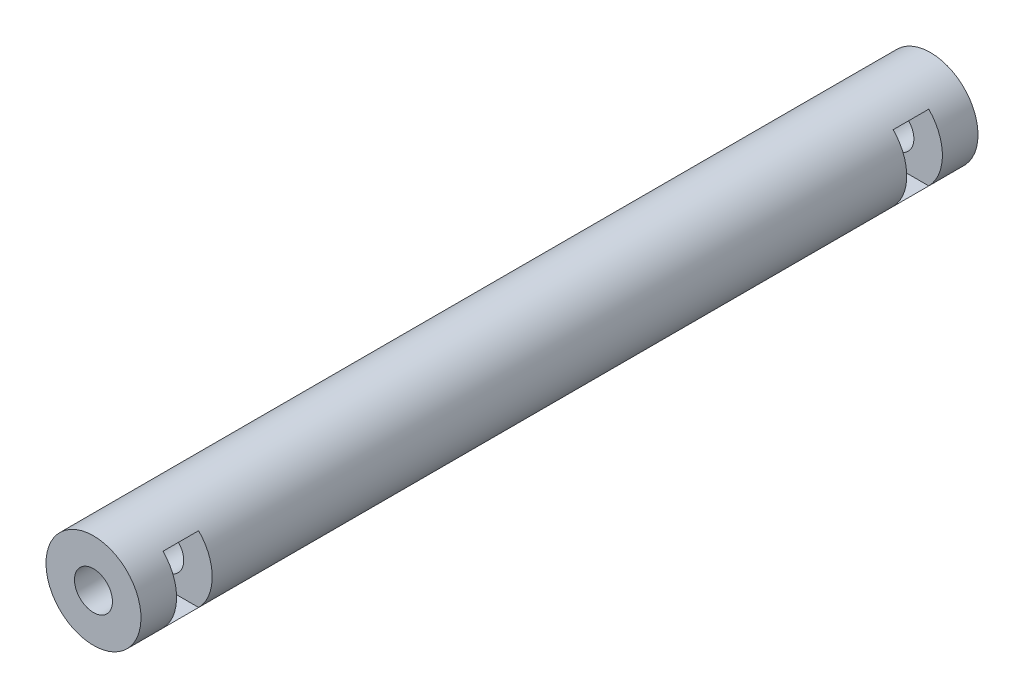
from build123d import *

# Parameters (mm, degrees)
SKETCH_1_R               = 4
EXTRUDE_1_DEPTH          = 70.491679884
CUT_EXTRUDE_1_DEPTH      = 82.76843482
CUT_EXTRUDE_1_DEPTH_BACK = 82.76843482
SKETCH_2_R               = 1.6
CUT_EXTRUDE_START        = -82.76843482
SKETCH_3_W               = 3
SKETCH_3_H               = 5.6
CUT_EXTRUDE_2_DEPTH      = 150.536869639


with BuildPart() as part:
    # ｽｹｯﾁ1 → ﾎﾞｽ - 押し出し1 (new body)
    with BuildSketch(Plane.XY):
        with Locations(Location((2, 37, 0), (0, 0, 90))):
            Circle(SKETCH_1_R)
    extrude(amount=EXTRUDE_1_DEPTH)

    # ｽｹｯﾁ2 → ｶｯﾄ - 押し出し1 (cut, two sides: drawn at the far end of the back side and taken through both)
    with BuildSketch(Plane(origin=(0, 0, 0), x_dir=(-1, 0, 0), z_dir=(0, 0, -1)).offset(-CUT_EXTRUDE_1_DEPTH_BACK)):
        with Locations((-2, 37)):
            Circle(SKETCH_2_R)
    extrude(amount=CUT_EXTRUDE_1_DEPTH + CUT_EXTRUDE_1_DEPTH_BACK, mode=Mode.SUBTRACT)

    # ｽｹｯﾁ3 → ｶｯﾄ - 押し出し2 (cut)
    with BuildSketch(Plane(origin=(0, 0, 0), x_dir=(0, 0, -1), z_dir=(1, 0, 0)).offset(CUT_EXTRUDE_START)):
        with Locations((-4.5, 37)):
            Rectangle(SKETCH_3_W, SKETCH_3_H)
    cut_extrude_2 = extrude(amount=CUT_EXTRUDE_2_DEPTH, mode=Mode.SUBTRACT)

    # ﾐﾗｰ1: ｶｯﾄ - 押し出し2 across plane
    add(cut_extrude_2.mirror(Plane(origin=(0, 0, 35.245839942), x_dir=(1, 0, 0), z_dir=(0, 0, -1))), mode=Mode.SUBTRACT)


solid = part.part
